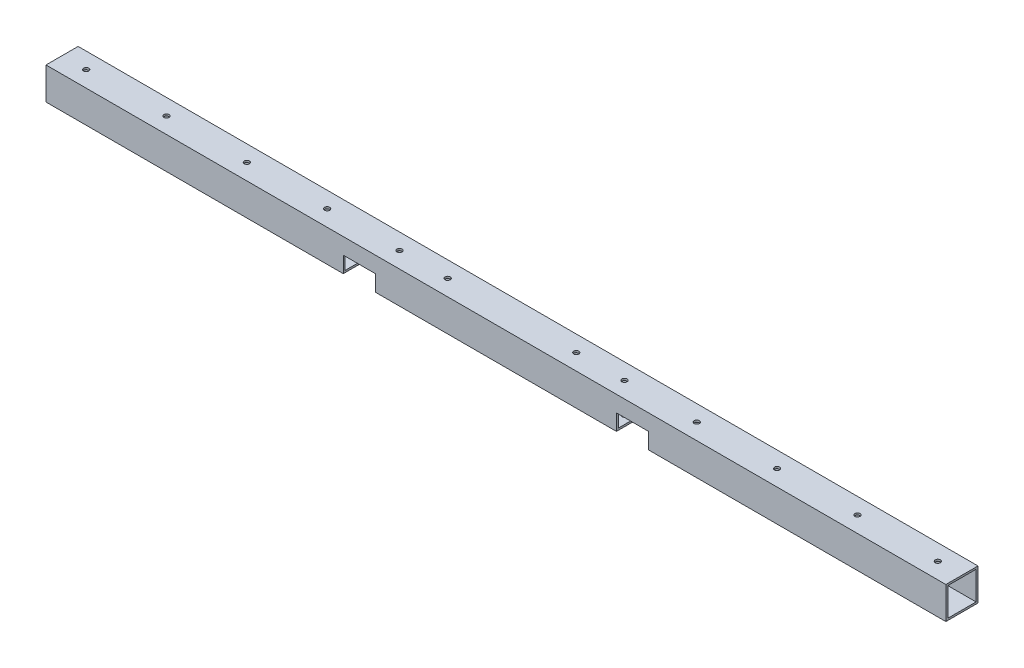
from build123d import *

# Parameters (mm, degrees)
SKETCH_1_W               = 20
SKETCH_1_H               = 20
SKETCH_1_W_2             = 17.6
SKETCH_1_H_2             = 17.6
EXTRUDE_2_DEPTH          = 280
CUT_EXTRUDE_2_DEPTH      = 281.356915378
CUT_EXTRUDE_2_DEPTH_BACK = 281.356915378
SKETCH_4_W               = 20
SKETCH_4_H               = 10
CUT_EXTRUDE_3_DEPTH      = 281.891438104
CUT_EXTRUDE_3_DEPTH_BACK = 281.891438104
SKETCH_5_R               = 1.6


with BuildPart() as part:
    # 草图1 → 凸台-拉伸2 (new, symmetric)
    with BuildSketch(Plane(origin=(0, 0, 0), x_dir=(0, 0, -1), z_dir=(1, 0, 0))):
        Rectangle(SKETCH_1_W, SKETCH_1_H)
        Rectangle(SKETCH_1_W_2, SKETCH_1_H_2, mode=Mode.SUBTRACT)
    extrude(amount=EXTRUDE_2_DEPTH, both=True)

    # 草图4 → 切除-拉伸2 (cut, two sides: drawn at the far end of the back side and taken through both)
    with BuildSketch(Plane.XY.offset(-CUT_EXTRUDE_2_DEPTH_BACK)):
        with Locations((85, -5)):
            Rectangle(SKETCH_4_W, SKETCH_4_H)
        with Locations((-85, -5)):
            Rectangle(SKETCH_4_W, SKETCH_4_H)
    extrude(amount=CUT_EXTRUDE_2_DEPTH + CUT_EXTRUDE_2_DEPTH_BACK, mode=Mode.SUBTRACT)

    # 草图5 → 切除-拉伸3 (cut, two sides: drawn at the far end of the back side and taken through both)
    with BuildSketch(Plane(origin=(0, 10, 0), x_dir=(1, 0, 0), z_dir=(0, 1, 0)).offset(-CUT_EXTRUDE_3_DEPTH_BACK)):
        with Locations(Location((115, 0, 0), (0, 0, 270))):
            Circle(SKETCH_5_R)
        with Locations(Location((165, 0, 0), (0, 0, 270))):
            Circle(SKETCH_5_R)
        with Locations(Location((265, 0, 0), (0, 0, 270))):
            Circle(SKETCH_5_R)
        with Locations(Location((215, 0, 0), (0, 0, 270))):
            Circle(SKETCH_5_R)
        with Locations(Location((-215, 0, 0), (0, 0, 90))):
            Circle(SKETCH_5_R)
        with Locations(Location((-265, 0, 0), (0, 0, 90))):
            Circle(SKETCH_5_R)
        with Locations(Location((-165, 0, 0), (0, 0, 90))):
            Circle(SKETCH_5_R)
        with Locations(Location((-115, 0, 0), (0, 0, 90))):
            Circle(SKETCH_5_R)
        with Locations(Location((70, 0, 0), (0, 0, 90))):
            Circle(SKETCH_5_R)
        with Locations(Location((-70, 0, 0), (0, 0, 90))):
            Circle(SKETCH_5_R)
        with Locations(Location((40, 0, 0), (0, 0, 90))):
            Circle(SKETCH_5_R)
        with Locations(Location((-40, 0, 0), (0, 0, 90))):
            Circle(SKETCH_5_R)
    extrude(amount=CUT_EXTRUDE_3_DEPTH + CUT_EXTRUDE_3_DEPTH_BACK, mode=Mode.SUBTRACT)


solid = part.part
